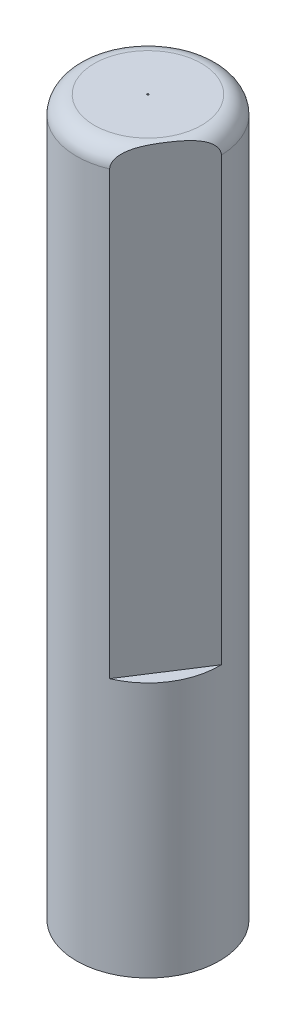
from build123d import *

# Parameters (mm, degrees)
SKETCH1_R           = 4
BOSS_EXTRUDE1_DEPTH = 40
FILLET1_R           = 1
CUT_EXTRUDE1_START  = -25.7
CUT_EXTRUDE1_DEPTH  = 25.7
SKETCH3_R           = 0.05
CUT_EXTRUDE2_DEPTH  = 0.1


with BuildPart() as part:
    # Sketch1 → Boss-Extrude1 (new body)
    with BuildSketch(Plane(origin=(0, 0, 0), x_dir=(1, 0, 0), z_dir=(0, 1, 0))):
        with Locations(Location((0, 0, 0), (0, 0, 270))):
            Circle(SKETCH1_R)
    extrude(amount=BOSS_EXTRUDE1_DEPTH)

    # Fillet1
    fillet1_edges = [part.edges().sort_by_distance(p)[0] for p in [
        (0, 40, -4),
    ]]
    fillet(fillet1_edges, radius=FILLET1_R)

    # Sketch2 → Cut-Extrude1 (cut)
    with BuildSketch(Plane(origin=(0, 40, 0), x_dir=(1, 0, 0), z_dir=(0, 1, 0)).offset(CUT_EXTRUDE1_START)):
        with BuildLine():
            Line((1.546188852, -3.68907848), (3.998512047, 0.109093573))
            ThreePointArc((3.998512047, 0.109093573), (3.360424787, -2.169687823), (1.546188852, -3.68907848))
        make_face()
    extrude(amount=CUT_EXTRUDE1_DEPTH, mode=Mode.SUBTRACT)

    # Sketch3 → Cut-Extrude2 (cut)
    with BuildSketch(Plane(origin=(0, 40, 0), x_dir=(1, 0, 0), z_dir=(0, 1, 0))):
        with Locations(Location((0, 0, 0), (0, 0, 270))):
            Circle(SKETCH3_R)
    extrude(amount=-CUT_EXTRUDE2_DEPTH, mode=Mode.SUBTRACT)


solid = part.part
